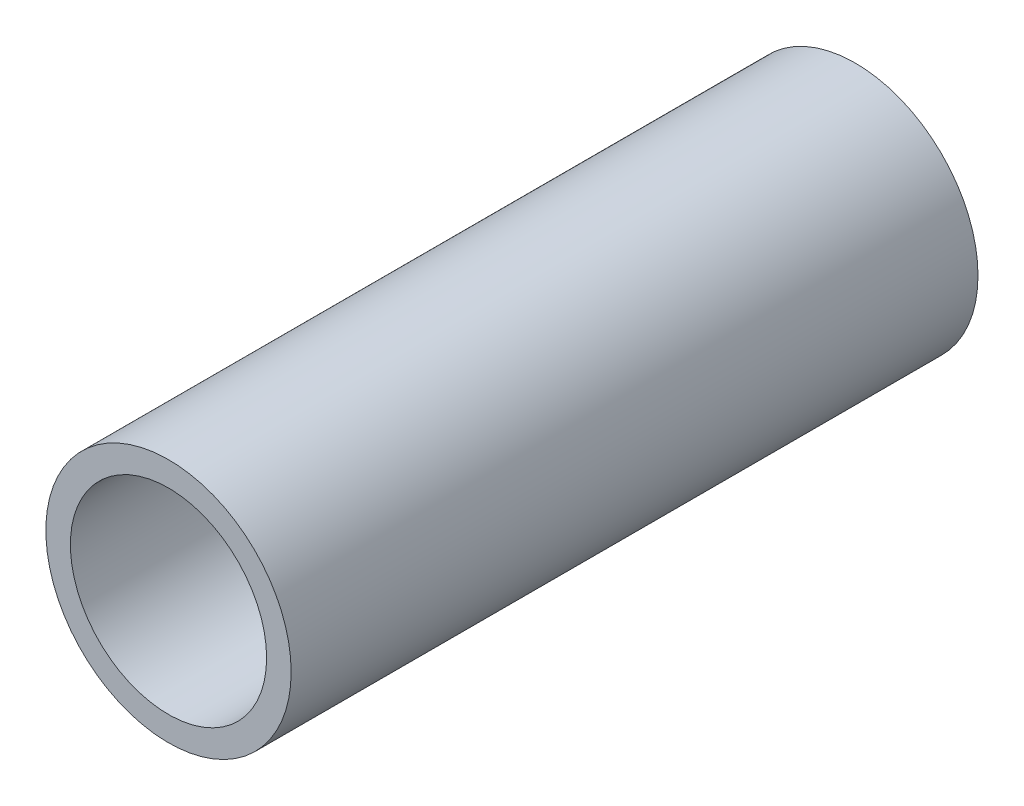
from build123d import *

# Parameters (mm, degrees)
SKETCH1_R           = 50
BOSS_EXTRUDE1_DEPTH = 280
SHELL3_T            = -10


with BuildPart() as part:
    # Sketch1 → Boss-Extrude1 (new body)
    with BuildSketch(Plane.XY):
        Circle(SKETCH1_R)
    extrude(amount=BOSS_EXTRUDE1_DEPTH)

    # Shell3
    shell3_openings = [part.faces().sort_by_distance(p)[0] for p in [
        (0, 0, 280),
        (0, 0, 0),
    ]]
    offset(amount=SHELL3_T, openings=shell3_openings, kind=Kind.INTERSECTION)


solid = part.part
